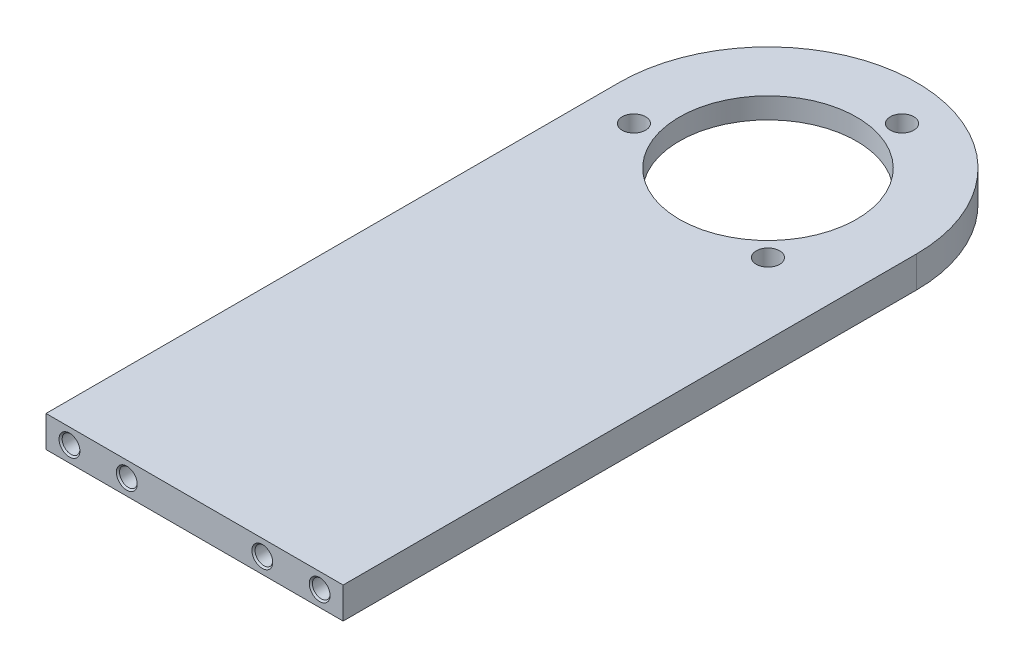
from build123d import *

# Parameters (mm, degrees)
AUFSATZ_LINEAR_AUSTRAGEN1_DEPTH                      = 6
SKIZZE1_4_R                                          = 25
SCHNITT_LINEAR_AUSTRAGEN1_DEPTH                      = 2
SKIZZE1_5_R                                          = 17
SCHNITT_LINEAR_AUSTRAGEN2_DEPTH                      = 142.529148941
SKIZZE1_6_R                                          = 2.25
SCHNITT_LINEAR_AUSTRAGEN3_DEPTH                      = 142.529148941
CSK_FOR_M3_RAISED_COUNTERSUNK_HEAD_SCREW_D           = 3.4
CSK_FOR_M3_RAISED_COUNTERSUNK_HEAD_SCREW_DEPTH       = 10
CSK_FOR_M3_RAISED_COUNTERSUNK_HEAD_SCREW_CSINK_D     = 4
CSK_FOR_M3_RAISED_COUNTERSUNK_HEAD_SCREW_CSINK_ANGLE = 90
CSK_FOR_M3_RAISED_COUNTERSUNK_HEAD_SCREW_TIP         = 1.021463052


with BuildPart() as part:
    # Skizze1 → Aufsatz-Linear austragen1 (new body)
    with BuildSketch(Plane(origin=(0, 0, 0), x_dir=(1, 0, 0), z_dir=(0, 1, 0))):
        with BuildLine():
            Line((0, 0), (-28.5, 0))
            Line((-28.5, 0), (-28.5, 110))
            ThreePointArc((-28.5, 110), (0, 138.5), (28.5, 110))
            Line((28.5, 110), (28.5, 0))
            Line((28.5, 0), (0, 0))
        make_face()
    extrude(amount=AUFSATZ_LINEAR_AUSTRAGEN1_DEPTH)

    # Skizze1<4> → Schnitt-Linear austragen1 (cut)
    with BuildSketch(Plane(origin=(0, 0, 0), x_dir=(1, 0, 0), z_dir=(0, 1, 0))):
        with Locations((0, 110)):
            Circle(SKIZZE1_4_R)
    extrude(amount=SCHNITT_LINEAR_AUSTRAGEN1_DEPTH, mode=Mode.SUBTRACT)

    # Skizze1<5> → Schnitt-Linear austragen2 (cut, through all)
    with BuildSketch(Plane(origin=(0, 0, 0), x_dir=(1, 0, 0), z_dir=(0, 1, 0))):
        with Locations((0, 110)):
            Circle(SKIZZE1_5_R)
    extrude(amount=SCHNITT_LINEAR_AUSTRAGEN2_DEPTH, mode=Mode.SUBTRACT)

    # Skizze1<6> → Schnitt-Linear austragen3 (cut, through all)
    with BuildSketch(Plane(origin=(0, 0, 0), x_dir=(1, 0, 0), z_dir=(0, 1, 0))):
        with Locations((14.849242405, 95.150757595)):
            Circle(SKIZZE1_6_R)
        with Locations((5.435199947, 130.284442352)):
            Circle(SKIZZE1_6_R)
        with Locations((-20.284442352, 104.564800053)):
            Circle(SKIZZE1_6_R)
    extrude(amount=SCHNITT_LINEAR_AUSTRAGEN3_DEPTH, mode=Mode.SUBTRACT)

    # CSK for M3 Raised Countersunk Head Screw 174741
    with Locations(Plane(origin=(-24, 3, 0), x_dir=(1, 0, 0), z_dir=(0, 0, 1))):
        with Locations((0, 0), (11, 0), (37, 0), (48, 0)):
            CounterSinkHole(CSK_FOR_M3_RAISED_COUNTERSUNK_HEAD_SCREW_D / 2, CSK_FOR_M3_RAISED_COUNTERSUNK_HEAD_SCREW_CSINK_D / 2, depth=CSK_FOR_M3_RAISED_COUNTERSUNK_HEAD_SCREW_DEPTH, counter_sink_angle=CSK_FOR_M3_RAISED_COUNTERSUNK_HEAD_SCREW_CSINK_ANGLE)
            with Locations((0, 0, -(CSK_FOR_M3_RAISED_COUNTERSUNK_HEAD_SCREW_DEPTH + CSK_FOR_M3_RAISED_COUNTERSUNK_HEAD_SCREW_TIP / 2))):  # 118° drill point
                Cone(0, CSK_FOR_M3_RAISED_COUNTERSUNK_HEAD_SCREW_D / 2, CSK_FOR_M3_RAISED_COUNTERSUNK_HEAD_SCREW_TIP, mode=Mode.SUBTRACT)


solid = part.part
